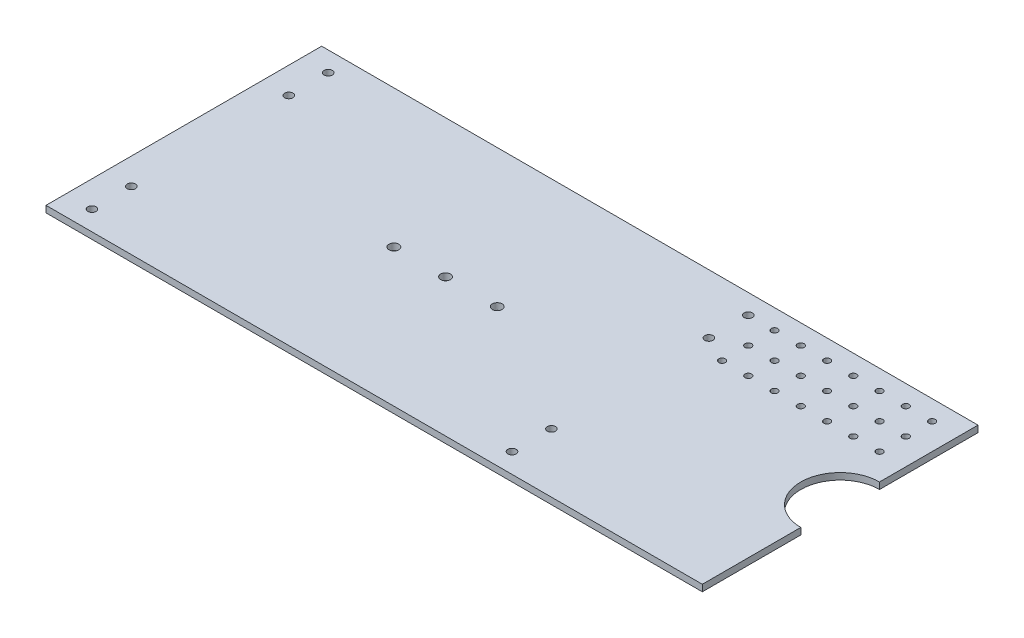
from build123d import *

# Parameters (mm, degrees)
SKETCH1_W               = 635
SKETCH1_H               = 266.7
BOSS_EXTRUDE1_DEPTH     = 6.35
CUT_EXTRUDE2_DEPTH      = 345.425311207
CUT_EXTRUDE2_DEPTH_BACK = 345.425311207
SKETCH2_R               = 4.7625
SKETCH3_R               = 3.96875
CUT_EXTRUDE4_DEPTH      = 345.425311207
SKETCH4_R               = 38.1
CUT_EXTRUDE6_DEPTH      = 345.425311207
SKETCH5_R               = 3.175
CUT_EXTRUDE7_DEPTH      = 345.425311207


with BuildPart() as part:
    # Sketch1 → Boss-Extrude1 (new body)
    with BuildSketch(Plane(origin=(0, 0, 0), x_dir=(1, 0, 0), z_dir=(0, 1, 0))):
        Rectangle(SKETCH1_W, SKETCH1_H)
    extrude(amount=BOSS_EXTRUDE1_DEPTH)

    # Sketch2 → Cut-Extrude2 (cut, two sides: drawn at the far end of the back side and taken through both)
    with BuildSketch(Plane(origin=(0, 0, 0), x_dir=(-1, 0, 0), z_dir=(0, 1, 0)).offset(-CUT_EXTRUDE2_DEPTH_BACK)):
        with Locations(Location((114.3, 0, 0), (0, 0, 90))):
            Circle(SKETCH2_R)
        with Locations(Location((64.3, 0, 0), (0, 0, 90))):
            Circle(SKETCH2_R)
        with Locations(Location((14.3, 0, 0), (0, 0, 90))):
            Circle(SKETCH2_R)
    extrude(amount=CUT_EXTRUDE2_DEPTH + CUT_EXTRUDE2_DEPTH_BACK, mode=Mode.SUBTRACT)

    # Sketch3 → Cut-Extrude4 (cut, through all)
    with BuildSketch(Plane(origin=(0, 0, 0), x_dir=(1, 0, 0), z_dir=(0, 1, 0))):
        with Locations(Location((-292.1, 114.3, 0), (0, 0, 270))):
            Circle(SKETCH3_R)
        with Locations(Location((-292.1, 76.2, 0), (0, 0, 270))):
            Circle(SKETCH3_R)
        with Locations(Location((-292.1, -76.2, 0), (0, 0, 270))):
            Circle(SKETCH3_R)
        with Locations(Location((-292.1, -114.3, 0), (0, 0, 270))):
            Circle(SKETCH3_R)
        with Locations(Location((114.3, 114.3, 0), (0, 0, 270))):
            Circle(SKETCH3_R)
        with Locations(Location((114.3, 76.2, 0), (0, 0, 270))):
            Circle(SKETCH3_R)
        with Locations(Location((114.3, -76.2, 0), (0, 0, 270))):
            Circle(SKETCH3_R)
        with Locations(Location((114.3, -114.3, 0), (0, 0, 270))):
            Circle(SKETCH3_R)
    extrude(amount=CUT_EXTRUDE4_DEPTH, mode=Mode.SUBTRACT)

    # Sketch4 → Cut-Extrude6 (cut, through all)
    with BuildSketch(Plane(origin=(0, 0, 0), x_dir=(1, 0, 0), z_dir=(0, 1, 0))):
        with Locations((317.5, 0)):
            Circle(SKETCH4_R)
    extrude(amount=CUT_EXTRUDE6_DEPTH, mode=Mode.SUBTRACT)

    # Sketch5 → Cut-Extrude7 (cut, through all)
    with BuildSketch(Plane(origin=(0, 6.35, 0), x_dir=(1, 0, 0), z_dir=(0, 1, 0))):
        with Locations(Location((139.7, 114.3, 0), (0, 0, 270))):
            Circle(SKETCH5_R)
        with Locations(Location((165.1, 114.3, 0), (0, 0, 270))):
            Circle(SKETCH5_R)
        with Locations(Location((190.5, 114.3, 0), (0, 0, 270))):
            Circle(SKETCH5_R)
        with Locations(Location((215.9, 114.3, 0), (0, 0, 270))):
            Circle(SKETCH5_R)
        with Locations(Location((241.3, 114.3, 0), (0, 0, 270))):
            Circle(SKETCH5_R)
        with Locations(Location((266.7, 114.3, 0), (0, 0, 270))):
            Circle(SKETCH5_R)
        with Locations(Location((292.1, 114.3, 0), (0, 0, 270))):
            Circle(SKETCH5_R)
        with Locations(Location((165.1, 88.9, 0), (0, 0, 270))):
            Circle(SKETCH5_R)
        with Locations(Location((190.5, 88.9, 0), (0, 0, 270))):
            Circle(SKETCH5_R)
        with Locations(Location((215.9, 88.9, 0), (0, 0, 270))):
            Circle(SKETCH5_R)
        with Locations(Location((241.3, 88.9, 0), (0, 0, 270))):
            Circle(SKETCH5_R)
        with Locations(Location((266.7, 88.9, 0), (0, 0, 270))):
            Circle(SKETCH5_R)
        with Locations(Location((292.1, 88.9, 0), (0, 0, 270))):
            Circle(SKETCH5_R)
        with Locations(Location((165.1, 63.5, 0), (0, 0, 270))):
            Circle(SKETCH5_R)
        with Locations(Location((190.5, 63.5, 0), (0, 0, 270))):
            Circle(SKETCH5_R)
        with Locations(Location((215.9, 63.5, 0), (0, 0, 270))):
            Circle(SKETCH5_R)
        with Locations(Location((241.3, 63.5, 0), (0, 0, 270))):
            Circle(SKETCH5_R)
        with Locations(Location((266.7, 63.5, 0), (0, 0, 270))):
            Circle(SKETCH5_R)
        with Locations(Location((292.1, 63.5, 0), (0, 0, 270))):
            Circle(SKETCH5_R)
        with Locations(Location((139.7, 88.9, 0), (0, 0, 270))):
            Circle(SKETCH5_R)
        with Locations(Location((139.7, 63.5, 0), (0, 0, 270))):
            Circle(SKETCH5_R)
    extrude(amount=-CUT_EXTRUDE7_DEPTH, mode=Mode.SUBTRACT)


solid = part.part
